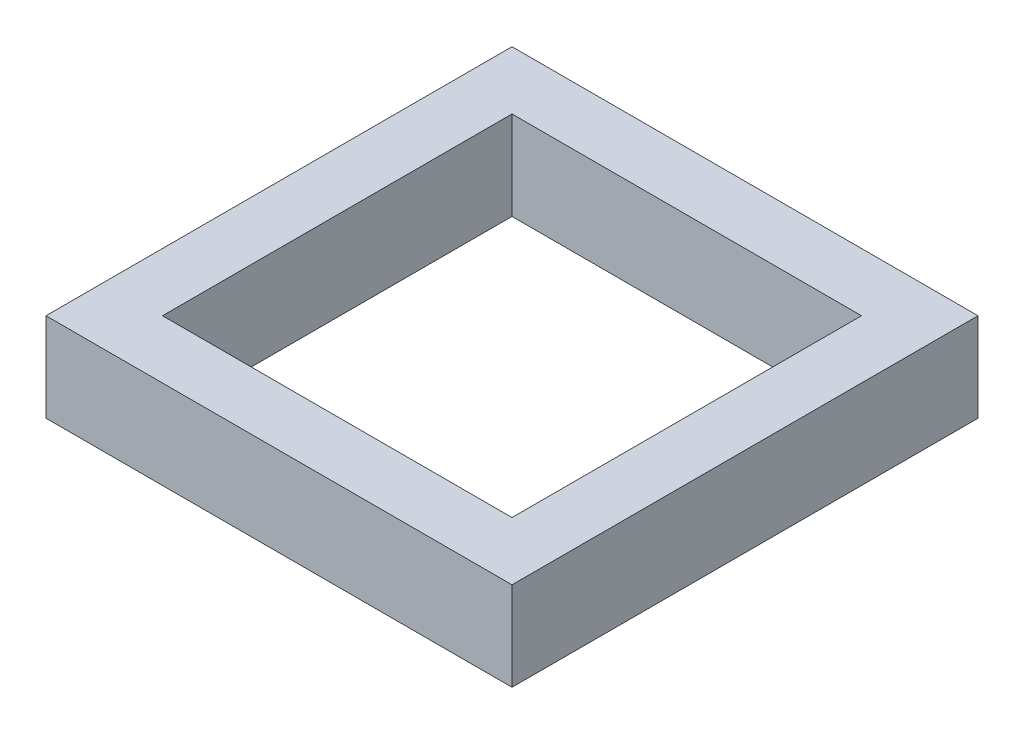
from build123d import *

# Parameters (mm, degrees)
SKETCH1_W           = 26.666
SKETCH1_H           = 26.666
SKETCH1_W_2         = 20
SKETCH1_H_2         = 20
BOSS_EXTRUDE1_DEPTH = 5.08


with BuildPart() as part:
    # Sketch1 → Boss-Extrude1 (new body)
    with BuildSketch(Plane(origin=(0, 0, 0), x_dir=(1, 0, 0), z_dir=(0, 1, 0))):
        with Locations((2.992125984, -2.244094488)):
            Rectangle(SKETCH1_W, SKETCH1_H)
        with Locations((2.992125984, -2.244094488)):
            Rectangle(SKETCH1_W_2, SKETCH1_H_2, mode=Mode.SUBTRACT)
    extrude(amount=BOSS_EXTRUDE1_DEPTH)


solid = part.part
